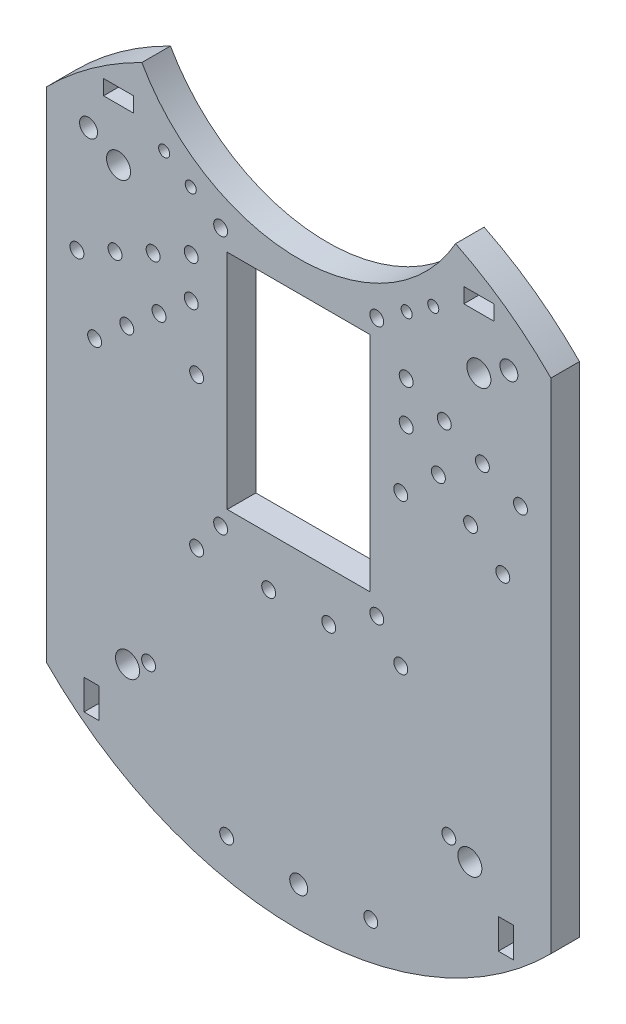
from build123d import *

# Parameters (mm, degrees)
SKETCH1_R           = 1.89865
SKETCH1_R_2         = 1.4732
BOSS_EXTRUDE3_DEPTH = 6.0452
SKETCH7_R           = 1.4732
CUT_EXTRUDE2_DEPTH  = 93.2317735
SKETCH9_R           = 1.4732
SKETCH9_W           = 30.226
SKETCH9_H           = 47.117
CUT_EXTRUDE3_DEPTH  = 14.732
SKETCH10_R          = 2.54
SKETCH10_W          = 6.35
SKETCH10_H          = 3.175
SKETCH10_W_2        = 3.175
SKETCH10_H_2        = 6.35
CUT_EXTRUDE4_DEPTH  = 6.0452
SKETCH12_R          = 1.4732
CUT_EXTRUDE5_DEPTH  = 6.0452
SKETCH13_R          = 1.1684
CUT_EXTRUDE6_DEPTH  = 6.0452


with BuildPart() as part:
    # Sketch1 → Boss-Extrude3 (new body)
    with BuildSketch(Plane.XY):
        with BuildLine():
            Line((-53.34, 52.724229724), (-53.34, -52.724229724))
            ThreePointArc((-53.34, -52.724229724), (0, -75), (53.34, -52.724229724))
            Line((53.34, -52.724229724), (53.34, 52.724229724))
            ThreePointArc((53.34, 52.724229724), (43.863063402, 60.836104979), (33.172661219, 67.264957799))
            ThreePointArc((33.172661219, 67.264957799), (0, 47.904876359), (-33.172661219, 67.264957799))
            ThreePointArc((-33.172661219, 67.264957799), (-43.863063402, 60.836104979), (-53.34, 52.724229724))
        make_face()
        with Locations((0, -66.675)):
            Circle(SKETCH1_R, mode=Mode.SUBTRACT)
        with Locations((-44.45, 49.6966108)):
            Circle(SKETCH1_R, mode=Mode.SUBTRACT)
        with Locations(Location((44.45, 49.6966108, 0), (0, 0, 180))):
            Circle(SKETCH1_R, mode=Mode.SUBTRACT)
        with Locations((-21.59, -15.875)):
            Circle(SKETCH1_R_2, mode=Mode.SUBTRACT)
        with Locations((-6.35, -15.875)):
            Circle(SKETCH1_R_2, mode=Mode.SUBTRACT)
        with Locations(Location((6.35, -15.875, 0), (0, 0, 180))):
            Circle(SKETCH1_R_2, mode=Mode.SUBTRACT)
        with Locations((-15.24, -65.475)):
            Circle(SKETCH1_R_2, mode=Mode.SUBTRACT)
        with Locations(Location((15.24, -65.475, 0), (0, 0, 180))):
            Circle(SKETCH1_R_2, mode=Mode.SUBTRACT)
        with Locations(Location((21.59, -15.875, 0), (0, 0, 180))):
            Circle(SKETCH1_R_2, mode=Mode.SUBTRACT)
        with Locations((6.35, 15.875)):
            Circle(SKETCH1_R_2, mode=Mode.SUBTRACT)
        with Locations(Location((-6.35, 15.875, 0), (0, 0, 180))):
            Circle(SKETCH1_R_2, mode=Mode.SUBTRACT)
        with Locations((21.59, 15.875)):
            Circle(SKETCH1_R_2, mode=Mode.SUBTRACT)
        with Locations(Location((-21.59, 15.875, 0), (0, 0, 180))):
            Circle(SKETCH1_R_2, mode=Mode.SUBTRACT)
    extrude(amount=BOSS_EXTRUDE3_DEPTH)

    # Sketch7 → Cut-Extrude2 (cut, through all)
    with BuildSketch(Plane.XY.offset(6.0452)):
        with Locations(Location((-31.75, -41.98, 0), (0, 0, 180))):
            Circle(SKETCH7_R)
        with Locations((31.75, -41.98)):
            Circle(SKETCH7_R)
    extrude(amount=-CUT_EXTRUDE2_DEPTH, mode=Mode.SUBTRACT)

    # Sketch9 → Cut-Extrude3 (cut)
    with BuildSketch(Plane.XY.offset(6.0452)):
        with Locations((-16.51, 45.301376359)):
            Circle(SKETCH9_R)
        with Locations((16.51, 45.301376359)):
            Circle(SKETCH9_R)
        with Locations((-16.51, -9.308623641)):
            Circle(SKETCH9_R)
        with Locations((16.51, -9.308623641)):
            Circle(SKETCH9_R)
        with Locations((0, 17.996376359)):
            Rectangle(SKETCH9_W, SKETCH9_H)
    extrude(amount=-CUT_EXTRUDE3_DEPTH, mode=Mode.SUBTRACT)

    # Sketch10 → Cut-Extrude4 (cut)
    with BuildSketch(Plane.XY.offset(6.0452)):
        with Locations((-36.195, -44.469229724)):
            Circle(SKETCH10_R)
        with Locations((36.195, -44.469229724)):
            Circle(SKETCH10_R)
        with Locations((-38.1, 45.999876359)):
            Circle(SKETCH10_R)
        with Locations((38.1, 45.999876359)):
            Circle(SKETCH10_R)
        with Locations((-38.1, 58.699876359)):
            Rectangle(SKETCH10_W, SKETCH10_H)
        with Locations((38.1, 58.699876359)):
            Rectangle(SKETCH10_W, SKETCH10_H)
        with Locations((-43.815, -54.629229724)):
            Rectangle(SKETCH10_W_2, SKETCH10_H_2)
        with Locations((43.815, -54.629229724)):
            Rectangle(SKETCH10_W_2, SKETCH10_H_2)
    extrude(amount=-CUT_EXTRUDE4_DEPTH, mode=Mode.SUBTRACT)

    # Sketch12 → Cut-Extrude5 (cut)
    with BuildSketch(Plane.XY.offset(6.0452)):
        with Locations((22.733, 37.304304366)):
            Circle(SKETCH12_R)
        with Locations((30.790076227, 33.547228019)):
            Circle(SKETCH12_R)
        with Locations((38.847152454, 29.790151672)):
            Circle(SKETCH12_R)
        with Locations((46.90422868, 26.033075325)):
            Circle(SKETCH12_R)
        with Locations((22.733, 28.829624443)):
            Circle(SKETCH12_R)
        with Locations((29.543135099, 23.115242593)):
            Circle(SKETCH12_R)
        with Locations((36.353270199, 17.400860743)):
            Circle(SKETCH12_R)
        with Locations((43.163405298, 11.686478893)):
            Circle(SKETCH12_R)
        with Locations((-43.163405298, 11.686478893)):
            Circle(SKETCH12_R)
        with Locations((-36.353270199, 17.400860743)):
            Circle(SKETCH12_R)
        with Locations((-29.543135099, 23.115242593)):
            Circle(SKETCH12_R)
        with Locations((-22.733, 28.829624443)):
            Circle(SKETCH12_R)
        with Locations((-46.90422868, 26.033075325)):
            Circle(SKETCH12_R)
        with Locations((-38.847152454, 29.790151672)):
            Circle(SKETCH12_R)
        with Locations((-30.790076227, 33.547228019)):
            Circle(SKETCH12_R)
        with Locations((-22.733, 37.304304366)):
            Circle(SKETCH12_R)
    extrude(amount=-CUT_EXTRUDE5_DEPTH, mode=Mode.SUBTRACT)

    # Sketch13 → Cut-Extrude6 (cut)
    with BuildSketch(Plane.XY.offset(6.0452)):
        with Locations((22.832493661, 49.627795037)):
            Circle(SKETCH13_R)
        with Locations((-22.832493661, 49.627795037)):
            Circle(SKETCH13_R)
        with Locations((-28.455572264, 53.419074276)):
            Circle(SKETCH13_R)
        with Locations((28.455572264, 53.419074276)):
            Circle(SKETCH13_R)
    extrude(amount=-CUT_EXTRUDE6_DEPTH, mode=Mode.SUBTRACT)


solid = part.part
